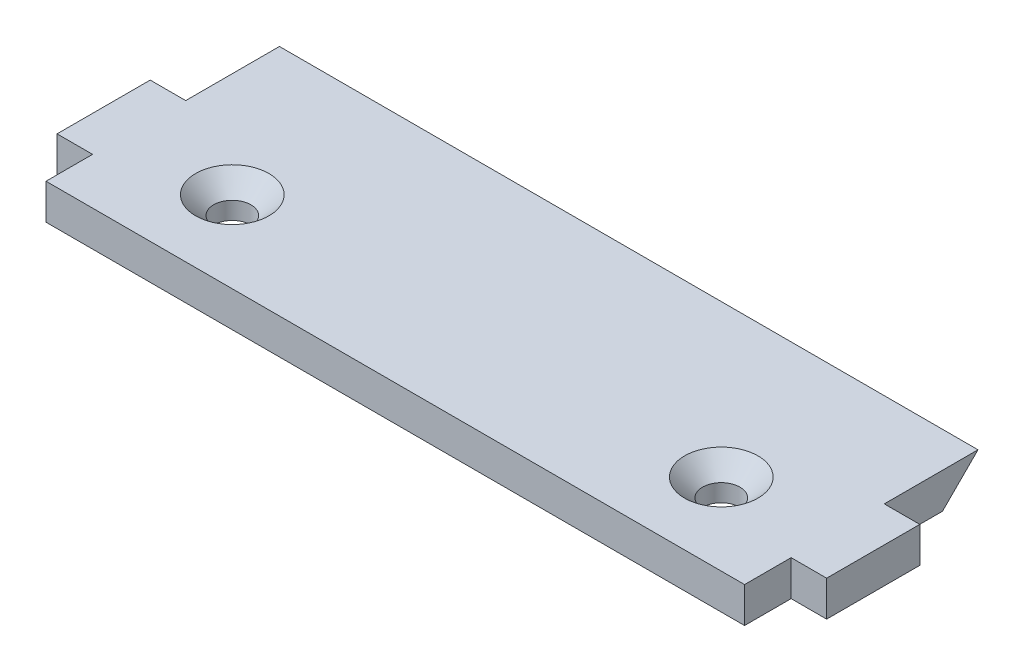
from build123d import *

# Parameters (mm, degrees)
SKETCH1_R           = 1.5
BOSS_EXTRUDE1_DEPTH = 3.05
CUT_EXTRUDE1_DEPTH  = 67.231469106


with BuildPart() as part:
    # Sketch1 → Boss-Extrude1 (new body)
    with BuildSketch(Plane(origin=(0, 0, 0), x_dir=(1, 0, 0), z_dir=(0, 1, 0))):
        Polygon((3.05, 20.05), (3.05, 12), (0, 12), (0, 4), (3.05, 4), (3.05, 0), (63.05, 0), (63.05, 4), (66.1, 4), (66.1, 12), (63.05, 12), (63.05, 20.05), align=None)
        with Locations(Location((54.05, 7, 0), (0, 0, 270))):
            Circle(SKETCH1_R, mode=Mode.SUBTRACT)
        with Locations(Location((12.05, 7, 0), (0, 0, 270))):
            Circle(SKETCH1_R, mode=Mode.SUBTRACT)
    extrude(amount=BOSS_EXTRUDE1_DEPTH)

    # Sketch5 → CSK for M3 Flat Head Machine Screw1 (revolve, cut)
    with BuildSketch(Plane(origin=(12.05, 3.05, -7), x_dir=(0, 0, 1), z_dir=(1, 0, 0))):
        Polygon((0, 0), (0, 3.05), (1.6, 3.05), (1.6, 1.55), (3.15, 0), align=None)
    revolve(axis=Axis((12.05, 9.4, -7), (0, -1, 0)), mode=Mode.SUBTRACT)

    # Sketch7 → CSK for M3 Flat Head Machine Screw2 (revolve, cut)
    with BuildSketch(Plane(origin=(54.05, 3.05, -7), x_dir=(0, 0, 1), z_dir=(1, 0, 0))):
        Polygon((0, 0), (0, 3.05), (1.6, 3.05), (1.6, 1.55), (3.15, 0), align=None)
    revolve(axis=Axis((54.05, 9.4, -7), (0, -1, 0)), mode=Mode.SUBTRACT)

    # Sketch8 → Cut-Extrude1 (cut, through all)
    with BuildSketch(Plane(origin=(63.05, 0, 0), x_dir=(0, 0, -1), z_dir=(1, 0, 0))):
        Polygon((20.05, 3.05), (17, 0), (20.05, 0), align=None)
    extrude(amount=-CUT_EXTRUDE1_DEPTH, mode=Mode.SUBTRACT)


solid = part.part
